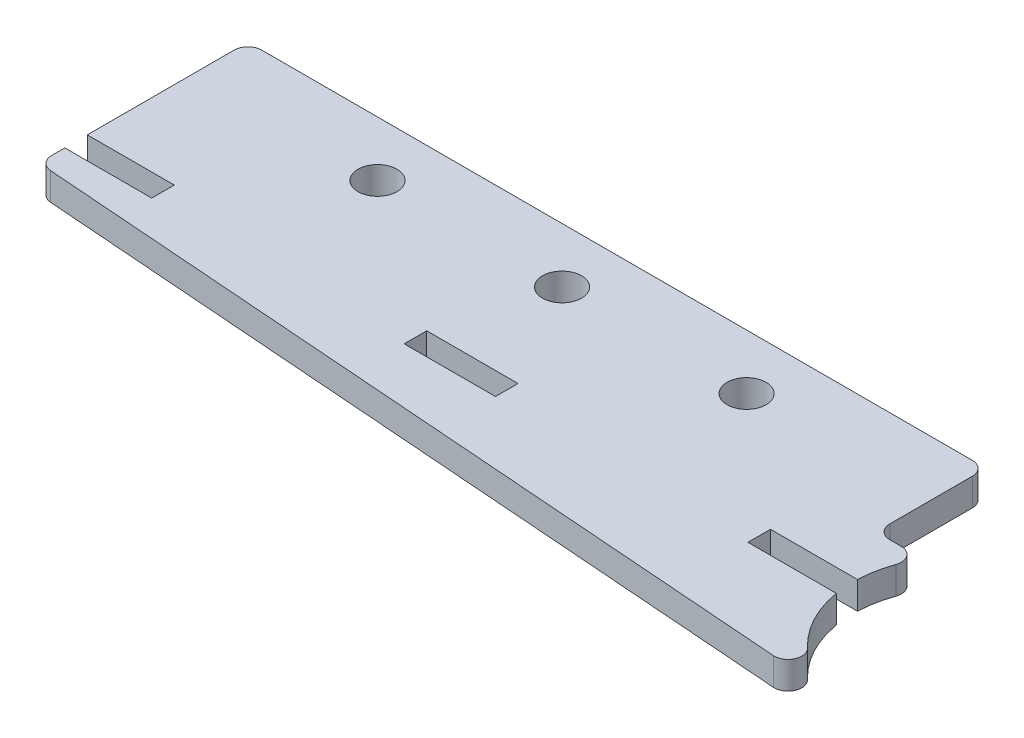
from build123d import *

# Parameters (mm, degrees)
BOSS_EXTRUDE1_DEPTH  = 3.175
FILLET1_R            = 1.5875
SKETCH2_W            = 85.216
SKETCH2_H            = 12.7
BOSS_EXTRUDE2_DEPTH  = 3.175
FILLET2_R            = 1.5875
M4_CLEARANCE_HOLE1_D = 4.5
CUT_EXTRUDE1_START   = -3.175
SKETCH5_W            = 9.525
SKETCH5_H            = 1.5875
SKETCH5_W_2          = 10.541
SKETCH5_H_2          = 2.6035
CUT_EXTRUDE1_DEPTH   = 3.175


with BuildPart() as part:
    # Sketch1 → Boss-Extrude1 (new body)
    with BuildSketch(Plane(origin=(0, 0, 0), x_dir=(1, 0, 0), z_dir=(0, 1, 0))):
        with BuildLine():
            Line((-101.6, 0), (-101.6, -5.08))
            Line((-101.6, -5.08), (-1.894344313, -12.557924177))
            ThreePointArc((-1.894344313, -12.557924177), (-11.442635346, -5.50963668), (-10.998522628, 6.35))
            Line((-10.998522628, 6.35), (-101.6, 6.35))
            Line((-101.6, 6.35), (-101.6, 0))
        make_face()
    extrude(amount=BOSS_EXTRUDE1_DEPTH)

    # Fillet1
    fillet1_edges = [part.edges().sort_by_distance(p)[0] for p in [
        (-10.998522628, 1.5875, -6.35),
        (-1.894344313, 1.5875, 12.557924177),
    ]]
    fillet(fillet1_edges, radius=FILLET1_R)

    # Sketch2 → Boss-Extrude2 (add)
    with BuildSketch(Plane(origin=(0, 3.175, 0), x_dir=(1, 0, 0), z_dir=(0, 1, 0))):
        with Locations((-58.992, 12.7)):
            Rectangle(SKETCH2_W, SKETCH2_H)
    extrude(amount=-BOSS_EXTRUDE2_DEPTH)

    # Fillet2
    fillet2_edges = [part.edges().sort_by_distance(p)[0] for p in [
        (-101.6, 1.5875, -19.05),
        (-16.384, 1.5875, -19.05),
        (-16.384, 1.5875, -6.35),
        (-101.6, 1.5875, 5.08),
    ]]
    fillet(fillet2_edges, radius=FILLET2_R)

    # M4 Clearance Hole1 (through all)
    with Locations(Plane(origin=(0, 3.175, 0), x_dir=(1, 0, 0), z_dir=(0, 1, 0))):
        with Locations((-80.296, 12.7), (-58.992, 12.7), (-37.688, 12.7)):
            Hole(M4_CLEARANCE_HOLE1_D / 2)

    # Sketch5 → Cut-Extrude1 (cut)
    with BuildSketch(Plane(origin=(0, 3.175, 0), x_dir=(1, 0, 0), z_dir=(0, 1, 0)).offset(CUT_EXTRUDE1_START)):
        with Locations((-96.8375, -0.79375)):
            Rectangle(SKETCH5_W, SKETCH5_H)
        Polygon((-101.6, 0), (-92.075, 0), (-92.075, -1.5875), (-101.6, -1.5875), (-101.6, -2.0955), (-91.567, -2.0955), (-91.567, 0.508), (-101.6, 0.508), align=None)
        with Locations((-57.15, -0.79375)):
            Rectangle(SKETCH5_W_2, SKETCH5_H_2)
        with BuildLine():
            Line((-22.733, -2.0955), (-12.525928299, -2.0955))
            ThreePointArc((-12.525928299, -2.0955), (-12.674906095, -0.797969605), (-12.689835933, 0.508))
            Line((-12.689835933, 0.508), (-22.733, 0.508))
            Line((-22.733, 0.508), (-22.733, -2.0955))
        make_face()
    extrude(amount=CUT_EXTRUDE1_DEPTH, mode=Mode.SUBTRACT)


solid = part.part
